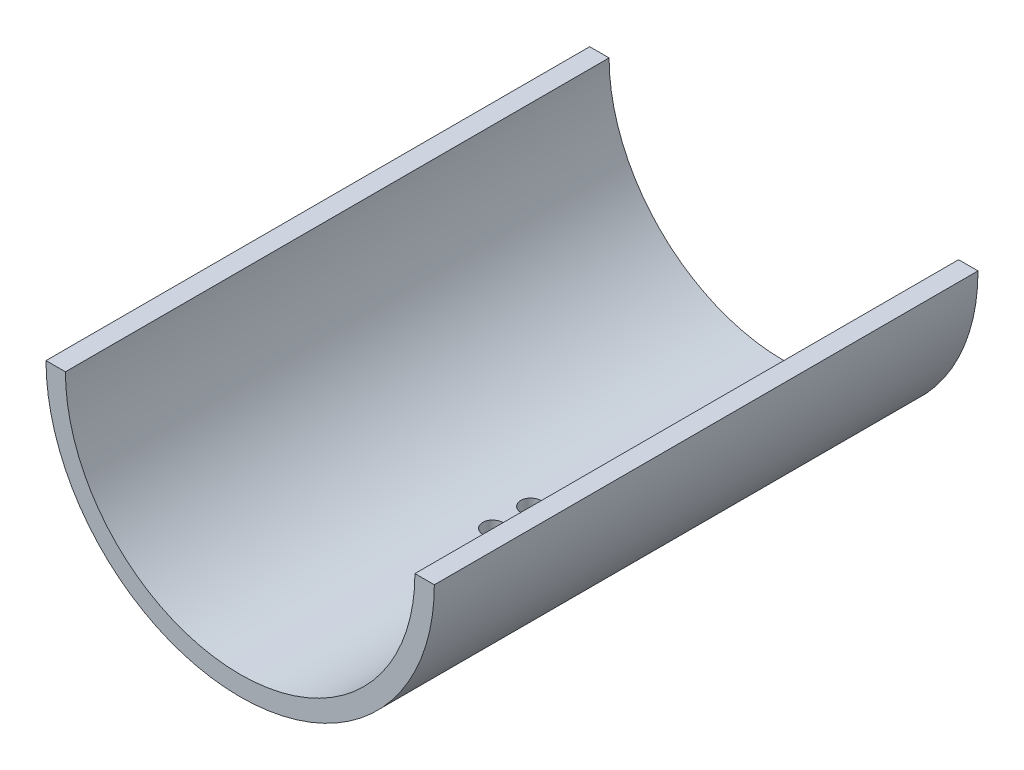
from build123d import *

# Parameters (mm, degrees)
SKETCH2_W          = 177.8
SKETCH2_H          = 6.35
REVOLVE1_ANGLE     = 180
SKETCH3_R          = 3.327499949
CUT_EXTRUDE1_DEPTH = 175.339362144


with BuildPart() as part:
    # Sketch2 → Revolve1 (revolve)
    with BuildSketch(Plane(origin=(0, 0, 0), x_dir=(0, 0, -1), z_dir=(0, -1, 0))):
        with Locations((60.53129924, -60.325)):
            Rectangle(SKETCH2_W, SKETCH2_H)
    revolve(axis=Axis((0, 0, 0), (0, 0, 1)), revolution_arc=REVOLVE1_ANGLE)

    # Sketch3 → Cut-Extrude1 (cut, through all)
    with BuildSketch(Plane(origin=(0, 0, 0), x_dir=(1, 0, 0), z_dir=(0, 1, 0))):
        with Locations(Location((0, 66.75429924, 0), (0, 0, 270))):
            Circle(SKETCH3_R)
        with Locations(Location((0, 54.30829924, 0), (0, 0, 270))):
            Circle(SKETCH3_R)
    extrude(amount=-CUT_EXTRUDE1_DEPTH, mode=Mode.SUBTRACT)


solid = part.part
